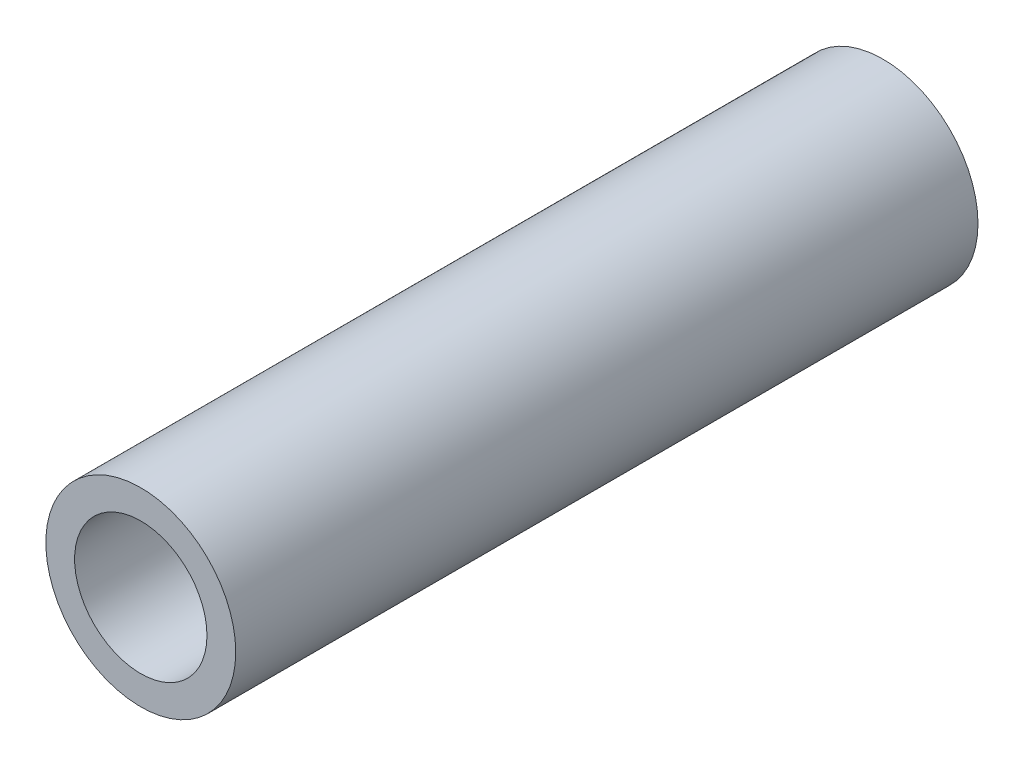
from build123d import *

# Parameters (mm, degrees)
SKETCH1_R           = 4.191
SKETCH1_R_2         = 2.921
BOSS_EXTRUDE1_DEPTH = 32.766


with BuildPart() as part:
    # Sketch1 → Boss-Extrude1 (new body)
    with BuildSketch(Plane.XY):
        Circle(SKETCH1_R)
        Circle(SKETCH1_R_2, mode=Mode.SUBTRACT)
    extrude(amount=BOSS_EXTRUDE1_DEPTH)


solid = part.part
